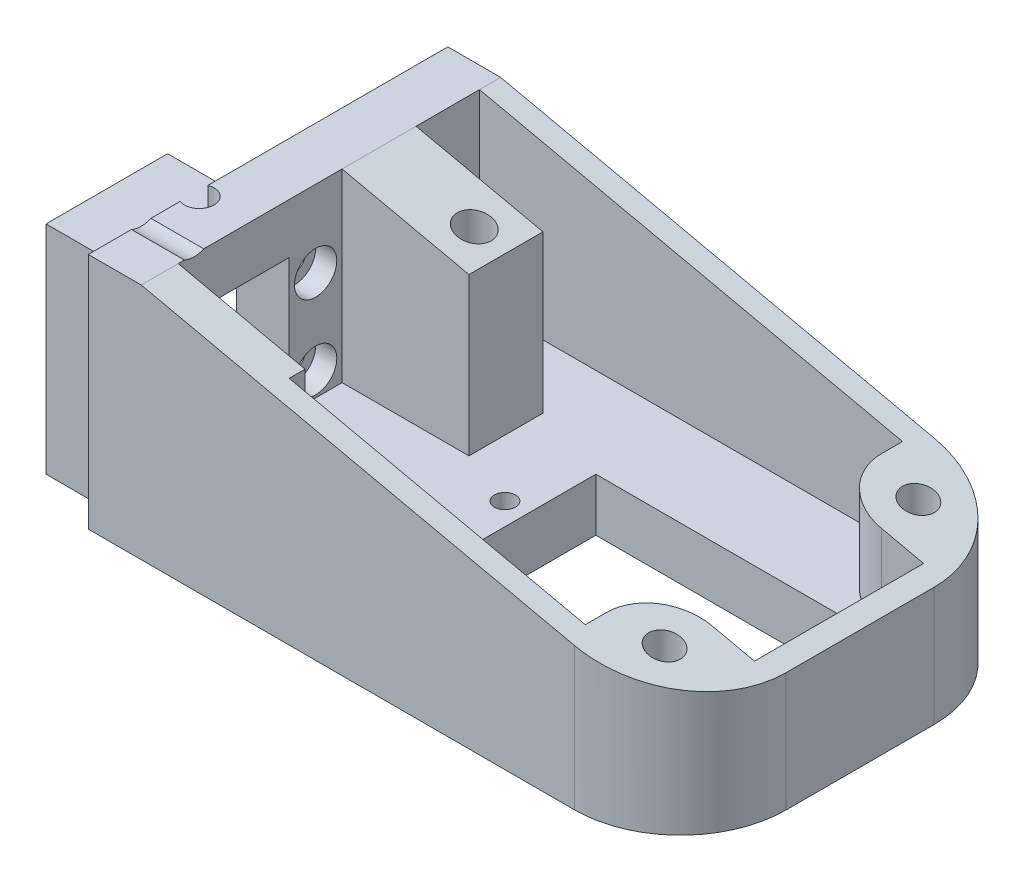
from build123d import *

# Parameters (mm, degrees)
BOSS_EXTRUDE1_DEPTH     = 22.5
CUT_EXTRUDE1_DEPTH      = 17.5
CUT_EXTRUDE2_DEPTH      = 15
CUT_EXTRUDE2_DEPTH_BACK = 66.29356783
SKETCH4_R               = 1
SKETCH5_W               = 10.5
SKETCH5_H               = 12.5
CUT_EXTRUDE3_DEPTH      = 20
SKETCH6_R               = 1.4
CUT_EXTRUDE4_DEPTH      = 10
SKETCH8_R               = 1
SKETCH8_W               = 24
SKETCH8_H               = 13
CUT_EXTRUDE6_DEPTH      = 68.810397433
SKETCH9_R               = 1.5
CUT_EXTRUDE7_DEPTH      = 70.269401614
SKETCH10_R              = 3
CUT_EXTRUDE8_DEPTH      = 5
SKETCH14_W              = 12
SKETCH14_H              = 17.5
BOSS_EXTRUDE3_DEPTH     = 3.5
SKETCH11_R              = 1.5
CUT_EXTRUDE9_DEPTH      = 10
SKETCH16_R              = 2
CUT_EXTRUDE11_DEPTH     = 2
SKETCH18_W              = 6.5
SKETCH18_H              = 2.5
CUT_EXTRUDE12_DEPTH     = 70.269401614
CUT_EXTRUDE14_DEPTH     = 70.269401614
SKETCH22_R              = 1.6
CUT_EXTRUDE15_DEPTH     = 70.269401614
SKETCH23_R              = 3
CUT_EXTRUDE18_DEPTH     = 3
CUT_EXTRUDE19_DEPTH     = 10
SKETCH25_W              = 6.5
SKETCH25_H              = 11.5
CUT_EXTRUDE20_DEPTH     = 2


with BuildPart() as part:
    # Sketch2 → Boss-Extrude1 (new body)
    with BuildSketch(Plane(origin=(0, 0, 0), x_dir=(1, 0, 0), z_dir=(0, 1, 0))):
        with BuildLine():
            Line((0, 0), (46, 0))
            ThreePointArc((46, 0), (53.071067812, 2.928932188), (56, 10))
            Line((56, 10), (56, 24))
            ThreePointArc((56, 24), (53.071067812, 31.071067812), (46, 34))
            Line((46, 34), (0, 34))
            Line((0, 34), (0, 14))
            Line((0, 14), (-6.5, 14))
            Line((-6.5, 14), (-6.5, 0))
            Line((-6.5, 0), (0, 0))
        make_face()
    extrude(amount=BOSS_EXTRUDE1_DEPTH)

    # Sketch3 → Cut-Extrude1 (cut)
    with BuildSketch(Plane(origin=(0, 22.5, 0), x_dir=(1, 0, 0), z_dir=(0, 1, 0))):
        with BuildLine():
            Line((45, 32), (5, 32))
            Line((5, 32), (5, 3.5))
            Line((5, 3.5), (17, 3.5))
            Line((17, 3.5), (17, 2))
            Line((17, 2), (45, 2))
            Line((45, 2), (45, 4))
            ThreePointArc((45, 4), (46.464466094, 7.535533906), (50, 9))
            Line((50, 9), (54, 9))
            Line((54, 9), (54, 25))
            Line((54, 25), (50, 25))
            ThreePointArc((50, 25), (46.464466094, 26.464466094), (45, 30))
            Line((45, 30), (45, 32))
        make_face()
    extrude(amount=-CUT_EXTRUDE1_DEPTH, mode=Mode.SUBTRACT)

    # Sketch4 → Cut-Extrude2 (cut, two sides: drawn at the far end of the back side and taken through both)
    with BuildSketch(Plane(origin=(5, 0, 0), x_dir=(0, 0, -1), z_dir=(1, 0, 0)).offset(-CUT_EXTRUDE2_DEPTH_BACK)):
        with Locations(Location((28.5, 15.25, 0), (0, 0, 180))):
            Circle(SKETCH4_R)
        with Locations(Location((28.5, 7.25, 0), (0, 0, 180))):
            Circle(SKETCH4_R)
        with Locations(Location((16.5, 7.25, 0), (0, 0, 180))):
            Circle(SKETCH4_R)
        with Locations(Location((16.5, 15.25, 0), (0, 0, 180))):
            Circle(SKETCH4_R)
    extrude(amount=CUT_EXTRUDE2_DEPTH + CUT_EXTRUDE2_DEPTH_BACK, mode=Mode.SUBTRACT)

    # Sketch5 → Cut-Extrude3 (cut)
    with BuildSketch(Plane.ZY.offset(6.5)):
        with Locations((-8.75, 11.5)):
            Rectangle(SKETCH5_W, SKETCH5_H)
    extrude(amount=-CUT_EXTRUDE3_DEPTH, mode=Mode.SUBTRACT)

    # Sketch6 → Cut-Extrude4 (cut)
    with BuildSketch(Plane(origin=(0, 22.5, 0), x_dir=(1, 0, 0), z_dir=(0, 1, 0))):
        with Locations(Location((0.5, 10, 0), (0, 0, 270))):
            Circle(SKETCH6_R)
    extrude(amount=-CUT_EXTRUDE4_DEPTH, mode=Mode.SUBTRACT)

    # Sketch8 → Cut-Extrude6 (cut, through all)
    with BuildSketch(Plane(origin=(0, 5, 0), x_dir=(1, 0, 0), z_dir=(0, 1, 0))):
        with Locations(Location((50.6, 17, 0), (0, 0, 270))):
            Circle(SKETCH8_R)
        with Locations(Location((22.4, 17, 0), (0, 0, 270))):
            Circle(SKETCH8_R)
        with Locations((36.5, 17)):
            Rectangle(SKETCH8_W, SKETCH8_H)
    extrude(amount=-CUT_EXTRUDE6_DEPTH, mode=Mode.SUBTRACT)

    # Sketch9 → Cut-Extrude7 (cut, through all)
    with BuildSketch(Plane(origin=(0, 22.5, 0), x_dir=(1, 0, 0), z_dir=(0, 1, 0))):
        with Locations(Location((49.5, 29, 0), (0, 0, 270))):
            Circle(SKETCH9_R)
        with Locations(Location((49.5, 5, 0), (0, 0, 270))):
            Circle(SKETCH9_R)
    extrude(amount=-CUT_EXTRUDE7_DEPTH, mode=Mode.SUBTRACT)

    # Sketch10 → Cut-Extrude8 (cut)
    with BuildSketch(Plane.XZ):
        with Locations(Location((49.5, -5, 0), (0, 0, 270))):
            Circle(SKETCH10_R)
        with Locations(Location((49.5, -29, 0), (0, 0, 270))):
            Circle(SKETCH10_R)
    extrude(amount=-CUT_EXTRUDE8_DEPTH, mode=Mode.SUBTRACT)

    # Sketch14 → Boss-Extrude3 (add, symmetric)
    with BuildSketch(Plane.XY.offset(-22.5)):
        with Locations((11, 13.75)):
            Rectangle(SKETCH14_W, SKETCH14_H)
    extrude(amount=BOSS_EXTRUDE3_DEPTH, both=True)

    # Sketch11 → Cut-Extrude9 (cut)
    with BuildSketch(Plane.XZ):
        with Locations(Location((8, -8, 0), (0, 0, 270))):
            Circle(SKETCH11_R)
        with Locations(Location((8, -26, 0), (0, 0, 270))):
            Circle(SKETCH11_R)
    extrude(amount=-CUT_EXTRUDE9_DEPTH, mode=Mode.SUBTRACT)

    # Sketch16 → Cut-Extrude11 (cut)
    with BuildSketch(Plane(origin=(5, 0, 0), x_dir=(0, 0, -1), z_dir=(1, 0, 0))):
        with Locations((28.5, 15.25)):
            Circle(SKETCH16_R)
        with Locations((28.5, 7.25)):
            Circle(SKETCH16_R)
        with Locations((16.5, 7.25)):
            Circle(SKETCH16_R)
        with Locations((16.5, 15.25)):
            Circle(SKETCH16_R)
    extrude(amount=-CUT_EXTRUDE11_DEPTH, mode=Mode.SUBTRACT)

    # Sketch18 → Cut-Extrude12 (cut, through all)
    with BuildSketch(Plane(origin=(0, 22.5, 0), x_dir=(1, 0, 0), z_dir=(0, 1, 0))):
        with Locations((-3.25, 1.25)):
            Rectangle(SKETCH18_W, SKETCH18_H)
    extrude(amount=-CUT_EXTRUDE12_DEPTH, mode=Mode.SUBTRACT)

    # Sketch21 → Cut-Extrude14 (cut, through all)
    with BuildSketch(Plane.XY):
        Polygon((5, 22.5), (56, 11.25), (56, 22.5), align=None)
    extrude(amount=-CUT_EXTRUDE14_DEPTH, mode=Mode.SUBTRACT)

    # Sketch22 → Cut-Extrude15 (cut, through all)
    with BuildSketch(Plane.XZ):
        with Locations(Location((14, -22.5, 0), (0, 0, 270))):
            Circle(SKETCH22_R)
    extrude(amount=-CUT_EXTRUDE15_DEPTH, mode=Mode.SUBTRACT)

    # Sketch23 → Cut-Extrude18 (cut)
    with BuildSketch(Plane.XZ):
        with Locations(Location((14, -22.5, 0), (0, 0, 270))):
            Circle(SKETCH23_R)
    extrude(amount=-CUT_EXTRUDE18_DEPTH, mode=Mode.SUBTRACT)

    # Sketch26 → Cut-Extrude19 (cut)
    with BuildSketch(Plane.ZY):
        with BuildLine():
            Line((-5.916515139, 22.5), (-4.083484861, 22.5))
            ThreePointArc((-4.083484861, 22.5), (-5, 22.3), (-5.916515139, 22.5))
        make_face()
    extrude(amount=-CUT_EXTRUDE19_DEPTH, mode=Mode.SUBTRACT)

    # Sketch25 → Cut-Extrude20 (cut)
    with BuildSketch(Plane(origin=(0, 22.5, 0), x_dir=(1, 0, 0), z_dir=(0, 1, 0))):
        with Locations((-3.25, 8.25)):
            Rectangle(SKETCH25_W, SKETCH25_H)
    extrude(amount=-CUT_EXTRUDE20_DEPTH, mode=Mode.SUBTRACT)


solid = part.part
